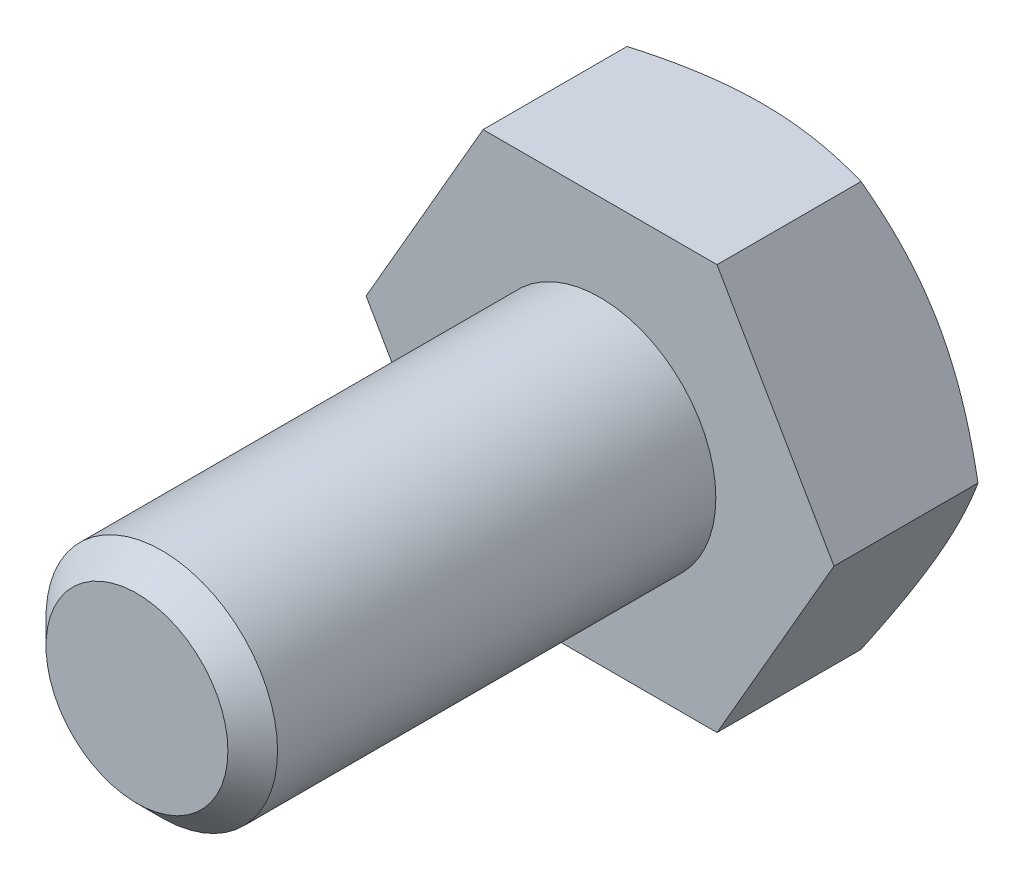
from build123d import *

# Parameters (mm, degrees)
EXTRUDE1_DEPTH = 2.8
SKETCH2_R      = 2
EXTRUDE2_DEPTH = 8
CHAMFER1_SIZE  = 0.429


with BuildPart() as part:
    # Sketch1 → Extrude1 (new body)
    with BuildSketch(Plane.XY):
        Polygon((4.041451884, 0), (2.020725942, 3.5), (-2.020725942, 3.5), (-4.041451884, 0), (-2.020725942, -3.5), (2.020725942, -3.5), align=None)
    extrude(amount=EXTRUDE1_DEPTH)

    # Sketch2 → Extrude2 (add)
    with BuildSketch(Plane.XY.offset(2.8)):
        Circle(SKETCH2_R)
    extrude(amount=EXTRUDE2_DEPTH)

    # Sketch3 → Cut-Revolve1 (revolve, cut)
    with BuildSketch(Plane(origin=(0, 0, 0), x_dir=(0, 0, -1), z_dir=(1, 0, 0))):
        Polygon((0, 3.5), (0, 103.5), (-57.735026919, 103.5), align=None)
    revolve(axis=Axis((0, 0, 0), (0, 0, -1)), mode=Mode.SUBTRACT)

    # Chamfer1
    chamfer1_edges = [part.edges().sort_by_distance(p)[0] for p in [
        (-2, 0, 10.8),
    ]]
    chamfer(chamfer1_edges, length=CHAMFER1_SIZE)


solid = part.part
